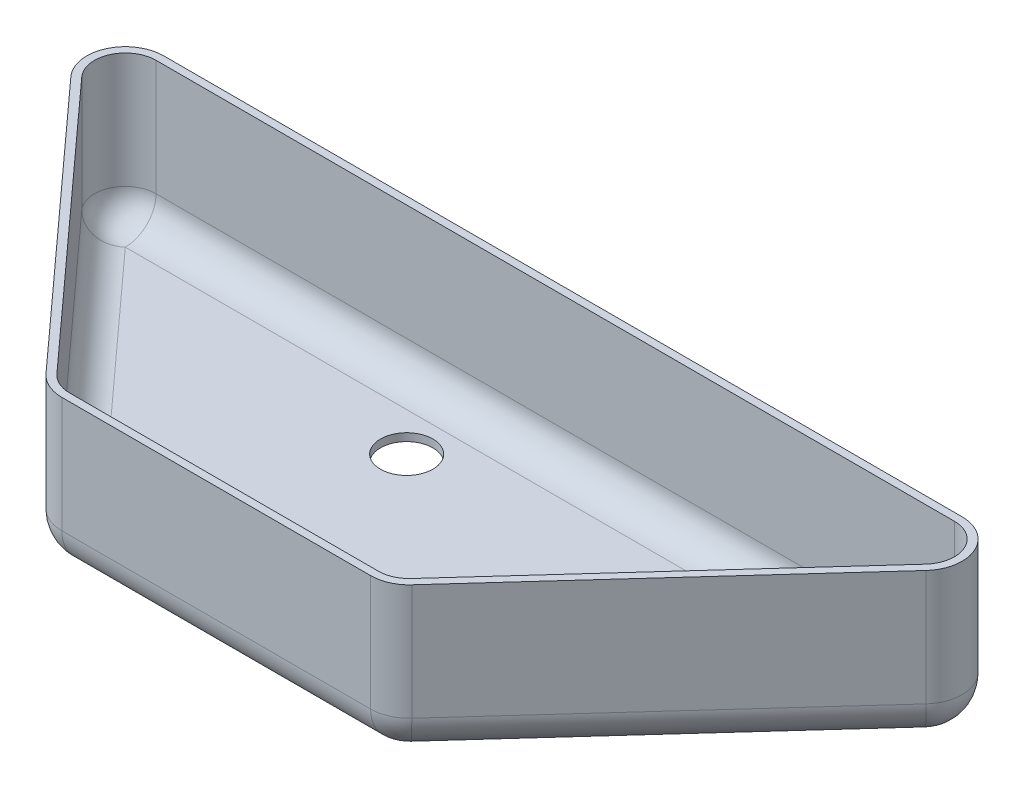
from build123d import *

# Parameters (mm, degrees)
BOSS_EXTRUDE1_DEPTH = 50.8
FILLET1_R           = 12.7
SHELL1_T            = -2.54
SKETCH2_R           = 8.636
CUT_EXTRUDE1_DEPTH  = 2.54


with BuildPart() as part:
    # Sketch1 → Boss-Extrude1 (new body)
    with BuildSketch(Plane(origin=(0, 0, 0), x_dir=(1, 0, 0), z_dir=(0, 1, 0))):
        with BuildLine():
            Line((-50.891439248, 0), (50.891439248, 0))
            ThreePointArc((50.891439248, 0), (56.033447259, 1.087517336), (60.29482175, 4.163818329))
            Line((60.29482175, 4.163818329), (140.996266194, 93.063818329))
            ThreePointArc((140.996266194, 93.063818329), (143.205366356, 106.742008011), (131.592883692, 114.3))
            Line((131.592883692, 114.3), (-131.592883692, 114.3))
            ThreePointArc((-131.592883692, 114.3), (-143.205366356, 106.742008011), (-140.996266194, 93.063818329))
            Line((-140.996266194, 93.063818329), (-60.29482175, 4.163818329))
            ThreePointArc((-60.29482175, 4.163818329), (-56.033447259, 1.087517336), (-50.891439248, 0))
        make_face()
    extrude(amount=BOSS_EXTRUDE1_DEPTH)

    # Fillet1
    fillet1_edges = [part.edges().sort_by_distance(p)[0] for p in [
        (-56.033447259, 0, -1.087517336),
        (0, 0, 0),
        (56.033447259, 0, -1.087517336),
        (100.645543972, 0, -48.613818329),
        (143.205366356, 0, -106.742008011),
        (0, 0, -114.3),
        (-143.205366356, 0, -106.742008011),
        (-100.645543972, 0, -48.613818329),
    ]]
    fillet(fillet1_edges, radius=FILLET1_R)

    # Shell1
    shell1_openings = [part.faces().sort_by_distance(p)[0] for p in [
        (0, 50.8, -65.668899596),
    ]]
    offset(amount=SHELL1_T, openings=shell1_openings, kind=Kind.INTERSECTION)

    # Sketch2 → Cut-Extrude1 (cut)
    with BuildSketch(Plane.XZ):
        with Locations(Location((-26.127205075, -88.9, 0), (0, 0, 270))):
            Circle(SKETCH2_R)
    extrude(amount=-CUT_EXTRUDE1_DEPTH, mode=Mode.SUBTRACT)


solid = part.part
